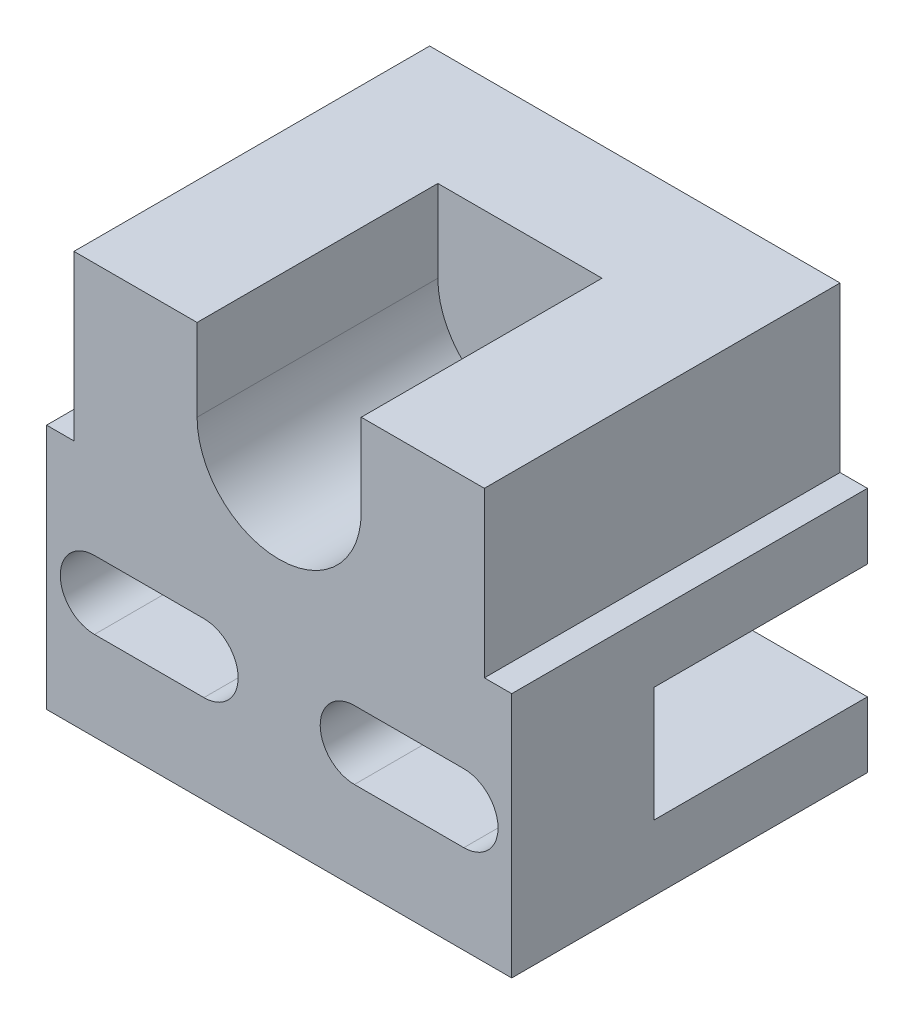
from build123d import *

# Parameters (mm, degrees)
BOSS_EXTRUDE1_DEPTH = 13
CUT_EXTRUDE1_DEPTH  = 9
SKETCH4_R           = 1.6
CUT_EXTRUDE2_DEPTH  = 20.448650339
SKETCH5_R           = 1.25
CUT_EXTRUDE3_DEPTH  = 22.592822882
CUT_EXTRUDE4_DEPTH  = 22.592822882
CUT_EXTRUDE5_DEPTH  = 7.8
SKETCH9_W           = 6.962435565
SKETCH9_H           = 4.2
CUT_EXTRUDE6_DEPTH  = 7.8
SKETCH10_R          = 1.4
BOSS_EXTRUDE2_DEPTH = 2.5
CHAMFER1_SIZE       = 0.5
BOSS_EXTRUDE3_START = 0.2
BOSS_EXTRUDE3_DEPTH = 0.2


with BuildPart() as part:
    # Sketch1 → Boss-Extrude1 (new body)
    with BuildSketch(Plane.XY):
        Polygon((-8.5, 0), (8.5, 0), (8.5, 9), (7.5, 9), (7.5, 15), (-7.5, 15), (-7.5, 9), (-8.5, 9), align=None)
    extrude(amount=BOSS_EXTRUDE1_DEPTH)

    # Sketch2 → Cut-Extrude1 (cut)
    with BuildSketch(Plane.XY.offset(13)):
        with BuildLine():
            Line((3, 18), (3, 12))
            ThreePointArc((3, 12), (0, 9), (-3, 12))
            Line((-3, 12), (-3, 18))
            ThreePointArc((-3, 18), (0, 21), (3, 18))
        make_face()
    extrude(amount=-CUT_EXTRUDE1_DEPTH, mode=Mode.SUBTRACT)

    # Sketch4 → Cut-Extrude2 (cut, through all)
    with BuildSketch(Plane.XY.offset(4)):
        with Locations((0, 12)):
            Circle(SKETCH4_R)
    extrude(amount=-CUT_EXTRUDE2_DEPTH, mode=Mode.SUBTRACT)

    # Sketch5 → Cut-Extrude3 (cut, through all)
    with BuildSketch(Plane.XY.offset(13)):
        with Locations((-4.75, 4.5)):
            Circle(SKETCH5_R)
        with Locations((4.75, 4.5)):
            Circle(SKETCH5_R)
    extrude(amount=-CUT_EXTRUDE3_DEPTH, mode=Mode.SUBTRACT)

    # Sketch7 → Cut-Extrude4 (cut, through all)
    with BuildSketch(Plane.XY.offset(13)):
        with BuildLine():
            Line((-6.75, 5.75), (-2.75, 5.75))
            ThreePointArc((-2.75, 5.75), (-1.5, 4.5), (-2.75, 3.25))
            Line((-2.75, 3.25), (-6.75, 3.25))
            ThreePointArc((-6.75, 3.25), (-8, 4.5), (-6.75, 5.75))
        make_face()
        with BuildLine():
            Line((6.75, 3.25), (2.75, 3.25))
            ThreePointArc((2.75, 3.25), (1.5, 4.5), (2.75, 5.75))
            Line((2.75, 5.75), (6.75, 5.75))
            ThreePointArc((6.75, 5.75), (8, 4.5), (6.75, 3.25))
        make_face()
    extrude(amount=-CUT_EXTRUDE4_DEPTH, mode=Mode.SUBTRACT)

    # Sketch8 → Cut-Extrude5 (cut)
    with BuildSketch(Plane(origin=(0, 0, 0), x_dir=(-1, 0, 0), z_dir=(0, 0, -1))):
        Polygon((-1.537564435, 6.6), (-3.962435565, 6.6), (-5.174871131, 4.5), (-3.962435565, 2.4), (-1.537564435, 2.4), (-0.325128869, 4.5), align=None)
        Polygon((1.537564435, 6.6), (0.325128869, 4.5), (1.537564435, 2.4), (3.962435565, 2.4), (5.174871131, 4.5), (3.962435565, 6.6), align=None)
    extrude(amount=-CUT_EXTRUDE5_DEPTH, mode=Mode.SUBTRACT)

    # Sketch9 → Cut-Extrude6 (cut)
    with BuildSketch(Plane(origin=(0, 0, 7.8), x_dir=(-1, 0, 0), z_dir=(0, 0, -1))):
        with Locations((5.018782218, 4.5)):
            Rectangle(SKETCH9_W, SKETCH9_H)
        with Locations((-5.018782218, 4.5)):
            Rectangle(SKETCH9_W, SKETCH9_H)
    extrude(amount=CUT_EXTRUDE6_DEPTH, mode=Mode.SUBTRACT)

    # Sketch10 → Boss-Extrude2 (add)
    with BuildSketch(Plane(origin=(0, 0, 0), x_dir=(-1, 0, 0), z_dir=(0, 0, -1))):
        with Locations(Location((0, 8.263139721, 0), (0, 0, 180))):
            Circle(SKETCH10_R)
        with Locations(Location((0, 2.263139721, 0), (0, 0, 150))):
            Circle(SKETCH10_R)
    extrude(amount=BOSS_EXTRUDE2_DEPTH)

    # Chamfer1
    chamfer1_edges = [part.edges().sort_by_distance(p)[0] for p in [
        (-1.4, 8.263139721, -2.5),
        (-1.212435565, 1.563139721, -2.5),
    ]]
    chamfer(chamfer1_edges, length=CHAMFER1_SIZE)

    # Sketch11 → Boss-Extrude3 (add)
    with BuildSketch(Plane.XY.offset(4).offset(BOSS_EXTRUDE3_START)):
        with BuildLine():
            Line((3, 15), (-3, 15))
            Line((-3, 15), (-3, 12))
            ThreePointArc((-3, 12), (0, 9), (3, 12))
            Line((3, 12), (3, 15))
        make_face()
    extrude(amount=-BOSS_EXTRUDE3_DEPTH)


solid = part.part
